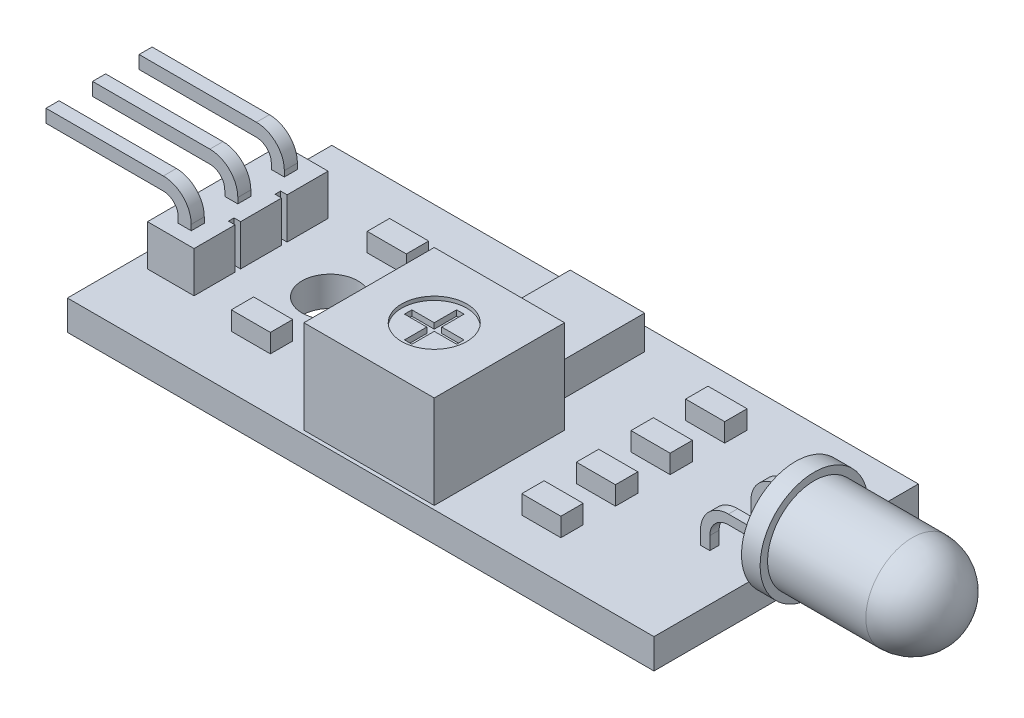
from build123d import *

# Parameters (mm, degrees)
SKETCH_1_W             = 31.5
SKETCH_1_H             = 14.2
SKETCH_1_R             = 1.5
EXTRUDE_1_DEPTH        = 1.6
SKETCH_2_W             = 7
SKETCH_2_H             = 7
EXTRUDE_2_DEPTH        = 5
SKETCH_3_R             = 1.75
CUT_EXTRUDE_1_DEPTH    = 0.2
CUT_EXTRUDE_2_DEPTH    = 0.3
SKETCH_6_W             = 4
SKETCH_6_H             = 4.5
EXTRUDE_3_DEPTH        = 1.8
SKETCH_7_W             = 2.1
SKETCH_7_H             = 1.2
SKETCH_7_W_2           = 1.2
SKETCH_7_H_2           = 2.1
EXTRUDE_4_DEPTH        = 1
EXTRUDE_START          = 1.6
EXTRUDE_5_DEPTH        = 0.5
PATTERN_LINEAR_1_COUNT = 2
PATTERN_LINEAR_1_PITCH = 2.7
EXTRUDE_6_DEPTH        = 0.35
PATTERN_LINEAR_2_COUNT = 2
PATTERN_LINEAR_2_PITCH = 2.5
PATTERN_LINEAR_3_COUNT = 2
PATTERN_LINEAR_3_PITCH = 2.5
SKETCH_12_W            = 2.5
SKETCH_12_H            = 2.2
SKETCH_12_W_2          = 1.8
SKETCH_12_H_2          = 0.3
EXTRUDE_7_DEPTH        = 2.2
SKETCH_13_R            = 0.4
EXTRUDE_8_DEPTH        = 0.5


with BuildPart() as part:
    # Эскиз1 → Бобышка-Вытянуть1 (new body)
    with BuildSketch(Plane(origin=(0, 0, 0), x_dir=(1, 0, 0), z_dir=(0, 1, 0))):
        Rectangle(SKETCH_1_W, SKETCH_1_H)
        with Locations(Location((-8.75, 0, 0), (0, 0, 270))):
            Circle(SKETCH_1_R, mode=Mode.SUBTRACT)
    extrude(amount=EXTRUDE_1_DEPTH)

    # Эскиз2 → Бобышка-Вытянуть2 (add)
    with BuildSketch(Plane(origin=(0, 1.6, 0), x_dir=(1, 0, 0), z_dir=(0, 1, 0))):
        with Locations((0.25, -3.4)):
            Rectangle(SKETCH_2_W, SKETCH_2_H)
    extrude(amount=EXTRUDE_2_DEPTH)

    # Эскиз3 → Вырез-Вытянуть1 (cut)
    with BuildSketch(Plane(origin=(0, 6.6, 0), x_dir=(1, 0, 0), z_dir=(0, 1, 0))):
        with Locations(Location((0.25, -3.4, 0), (0, 0, 270))):
            Circle(SKETCH_3_R)
    extrude(amount=-CUT_EXTRUDE_1_DEPTH, mode=Mode.SUBTRACT)

    # Эскиз4 → Вырез-Вытянуть2 (cut)
    with BuildSketch(Plane(origin=(0, 6.4, 0), x_dir=(1, 0, 0), z_dir=(0, 1, 0))):
        Polygon((0.05, -2), (0.45, -2), (0.45, -3.2), (1.65, -3.2), (1.65, -3.6), (0.45, -3.6), (0.45, -4.8), (0.05, -4.8), (0.05, -3.6), (-1.15, -3.6), (-1.15, -3.2), (0.05, -3.2), align=None)
    extrude(amount=-CUT_EXTRUDE_2_DEPTH, mode=Mode.SUBTRACT)

    # Эскиз6 → Бобышка-Вытянуть3 (add)
    with BuildSketch(Plane(origin=(0, 1.6, 0), x_dir=(1, 0, 0), z_dir=(0, 1, 0))):
        with Locations((0.25, 3.65)):
            Rectangle(SKETCH_6_W, SKETCH_6_H)
    extrude(amount=EXTRUDE_3_DEPTH)

    # Эскиз7 → Бобышка-Вытянуть4 (add)
    with BuildSketch(Plane(origin=(0, 1.6, 0), x_dir=(1, 0, 0), z_dir=(0, 1, 0))):
        with Locations((7.6, 1.466666667)):
            Rectangle(SKETCH_7_W, SKETCH_7_H)
        with Locations((7.6, 4.4)):
            Rectangle(SKETCH_7_W, SKETCH_7_H)
        with Locations((-8.75, 3.65)):
            Rectangle(SKETCH_7_W, SKETCH_7_H)
        with Locations((-5.15, 2.95)):
            Rectangle(SKETCH_7_W_2, SKETCH_7_H_2)
        with Locations((-5.15, -2.95)):
            Rectangle(SKETCH_7_W_2, SKETCH_7_H_2)
        with Locations((-8.75, -3.65)):
            Rectangle(SKETCH_7_W, SKETCH_7_H)
        with Locations((7.6, -4.4)):
            Rectangle(SKETCH_7_W, SKETCH_7_H)
        with Locations((7.6, -1.466666667)):
            Rectangle(SKETCH_7_W, SKETCH_7_H)
    extrude(amount=EXTRUDE_4_DEPTH)

    # Эскиз9 → Бобышка-Вытянуть5 (add)
    with BuildSketch(Plane.XY.offset(EXTRUDE_START)):
        with BuildLine():
            Line((12.75, 2.3), (12.75, -0.5))
            Line((12.75, -0.5), (13.25, -0.5))
            Line((13.25, -0.5), (13.25, 2.3))
            ThreePointArc((13.25, 2.3), (13.542893219, 3.007106781), (14.25, 3.3))
            Line((14.25, 3.3), (16.25, 3.3))
            Line((16.25, 3.3), (16.25, 3.8))
            Line((16.25, 3.8), (14.25, 3.8))
            ThreePointArc((14.25, 3.8), (13.189339828, 3.360660172), (12.75, 2.3))
        make_face()
    extrude_5 = extrude(amount=-EXTRUDE_5_DEPTH)

    # Линейный массив1: Бобышка-Вытянуть5 ×2
    with Locations(*[(0, 0, -i * PATTERN_LINEAR_1_PITCH) for i in range(1, PATTERN_LINEAR_1_COUNT)]):
        add(extrude_5)

    # Эскиз10 → Повернуть1 (revolve)
    with BuildSketch(Plane.XY, mode=Mode.PRIVATE) as revolve_1_sk:
        with BuildLine():
            Line((16.25, 3.55), (16.25, 6.45))
            Line((16.25, 6.45), (17.25, 6.45))
            Line((17.25, 6.45), (17.25, 6.05))
            Line((17.25, 6.05), (22.53, 6.05))
            ThreePointArc((22.53, 6.05), (24.297766953, 5.317766953), (25.03, 3.55))
            Line((25.03, 3.55), (16.25, 3.55))
        make_face()
    revolve(revolve_1_sk.sketch.rotate(Axis((16.25, 3.55, 0), (1, 0, 0)), 90), axis=Axis((16.25, 3.55, 0), (1, 0, 0)))

    # Эскиз11 → Бобышка-Вытянуть6 (add, symmetric)
    with BuildSketch(Plane.XY):
        with BuildLine():
            Line((-13.35, -0.5), (-14.05, -0.5))
            Line((-14.05, -0.5), (-14.05, 4.1))
            ThreePointArc((-14.05, 4.1), (-14.284314575, 4.665685425), (-14.85, 4.9))
            Line((-14.85, 4.9), (-21.15, 4.9))
            Line((-21.15, 4.9), (-21.15, 5.6))
            Line((-21.15, 5.6), (-14.85, 5.6))
            ThreePointArc((-14.85, 5.6), (-13.789339828, 5.160660172), (-13.35, 4.1))
            Line((-13.35, 4.1), (-13.35, -0.5))
        make_face()
    extrude_6 = extrude(amount=EXTRUDE_6_DEPTH, both=True)

    # Линейный массив2: Бобышка-Вытянуть6 ×2
    with Locations(*[(0, 0, i * PATTERN_LINEAR_2_PITCH) for i in range(1, PATTERN_LINEAR_2_COUNT)]):
        add(extrude_6)

    # Линейный массив3: Бобышка-Вытянуть6 ×2
    with Locations(*[(0, 0, -i * PATTERN_LINEAR_3_PITCH) for i in range(1, PATTERN_LINEAR_3_COUNT)]):
        add(extrude_6)

    # Эскиз12 → Бобышка-Вытянуть7 (add)
    with BuildSketch(Plane(origin=(0, 1.6, 0), x_dir=(1, 0, 0), z_dir=(0, 1, 0))):
        with Locations((-13.7, 2.5)):
            Rectangle(SKETCH_12_W, SKETCH_12_H)
        with Locations((-13.7, 1.25)):
            Rectangle(SKETCH_12_W_2, SKETCH_12_H_2)
        with Locations((-13.7, 0)):
            Rectangle(SKETCH_12_W, SKETCH_12_H)
        with Locations((-13.7, -1.25)):
            Rectangle(SKETCH_12_W_2, SKETCH_12_H_2)
        with Locations((-13.7, -2.5)):
            Rectangle(SKETCH_12_W, SKETCH_12_H)
    extrude(amount=EXTRUDE_7_DEPTH)

    # Эскиз13 → Бобышка-Вытянуть8 (add)
    with BuildSketch(Plane.XZ):
        with Locations(Location((-2.25, 3.6, 0), (0, 0, 90))):
            Circle(SKETCH_13_R)
        with Locations(Location((0.25, 1.1, 0), (0, 0, 90))):
            Circle(SKETCH_13_R)
        with Locations(Location((2.75, 3.6, 0), (0, 0, 90))):
            Circle(SKETCH_13_R)
    extrude(amount=EXTRUDE_8_DEPTH)


solid = part.part
